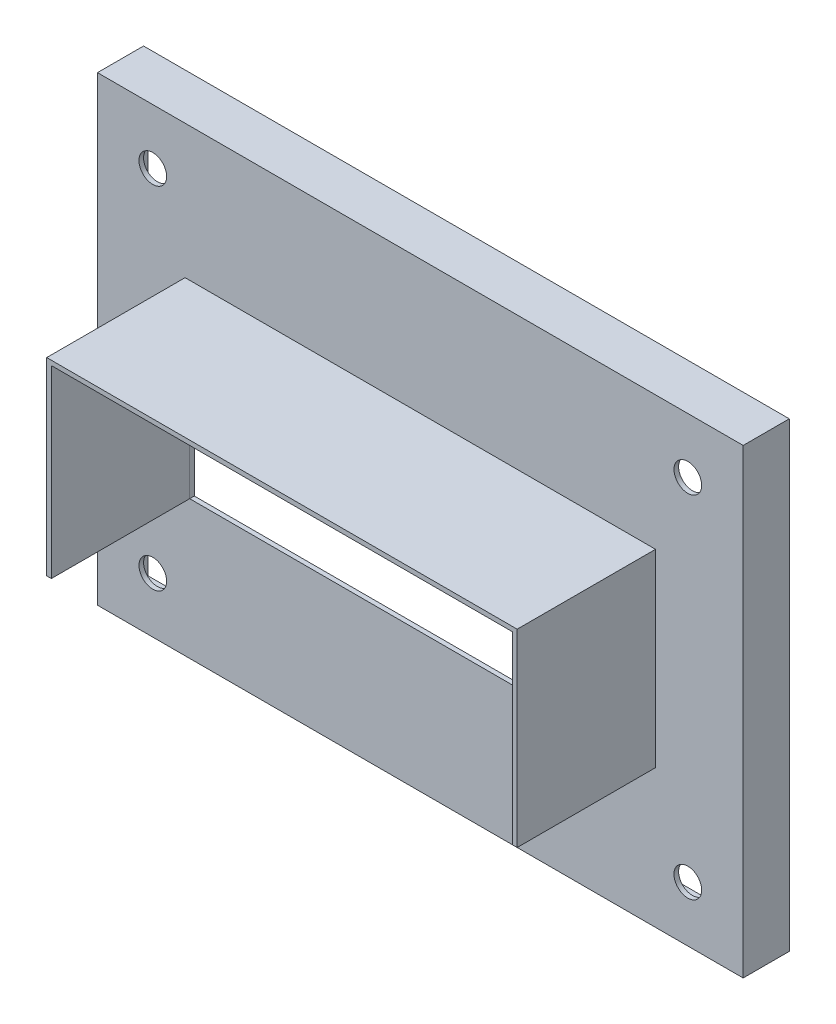
from build123d import *

# Parameters (mm, degrees)
CROQUIS1_W              = 140
CROQUIS1_H              = 100
CROQUIS1_W_2            = 138
CROQUIS1_H_2            = 98
SALIENTE_EXTRUIR1_DEPTH = 10
CROQUIS2_W              = 138
CROQUIS2_H              = 98
SALIENTE_EXTRUIR2_DEPTH = 1
CROQUIS4_R              = 3
CROQUIS4_W              = 100
CROQUIS4_H              = 40
CORTAR_EXTRUIR1_DEPTH   = 1
SALIENTE_EXTRUIR3_DEPTH = 30


with BuildPart() as part:
    # Croquis1 → Saliente-Extruir1 (new body)
    with BuildSketch(Plane.XY):
        Rectangle(CROQUIS1_W, CROQUIS1_H)
        Rectangle(CROQUIS1_W_2, CROQUIS1_H_2, mode=Mode.SUBTRACT)
    extrude(amount=-SALIENTE_EXTRUIR1_DEPTH)

    # Croquis2 → Saliente-Extruir2 (add)
    with BuildSketch(Plane.XY):
        Rectangle(CROQUIS2_W, CROQUIS2_H)
    extrude(amount=-SALIENTE_EXTRUIR2_DEPTH)

    # Croquis4 → Cortar-Extruir1 (cut)
    with BuildSketch(Plane.XY):
        with Locations((-58, 38)):
            Circle(CROQUIS4_R)
        with Locations(Location((58, 38, 0), (0, 0, 180))):
            Circle(CROQUIS4_R)
        with Locations((58, -38)):
            Circle(CROQUIS4_R)
        with Locations(Location((-58, -38, 0), (0, 0, 180))):
            Circle(CROQUIS4_R)
        Rectangle(CROQUIS4_W, CROQUIS4_H)
    extrude(amount=-CORTAR_EXTRUIR1_DEPTH, mode=Mode.SUBTRACT)


with BuildPart() as body_2:
    # Croquis5 → Saliente-Extruir3 (new body)
    with BuildSketch(Plane.XY):
        Polygon((-50, -20), (-50, 20), (50, 20), (50, -20), (51, -20), (51, 21), (-51, 21), (-51, -20), align=None)
    extrude(amount=SALIENTE_EXTRUIR3_DEPTH)


solid = Compound([part.part, body_2.part])
